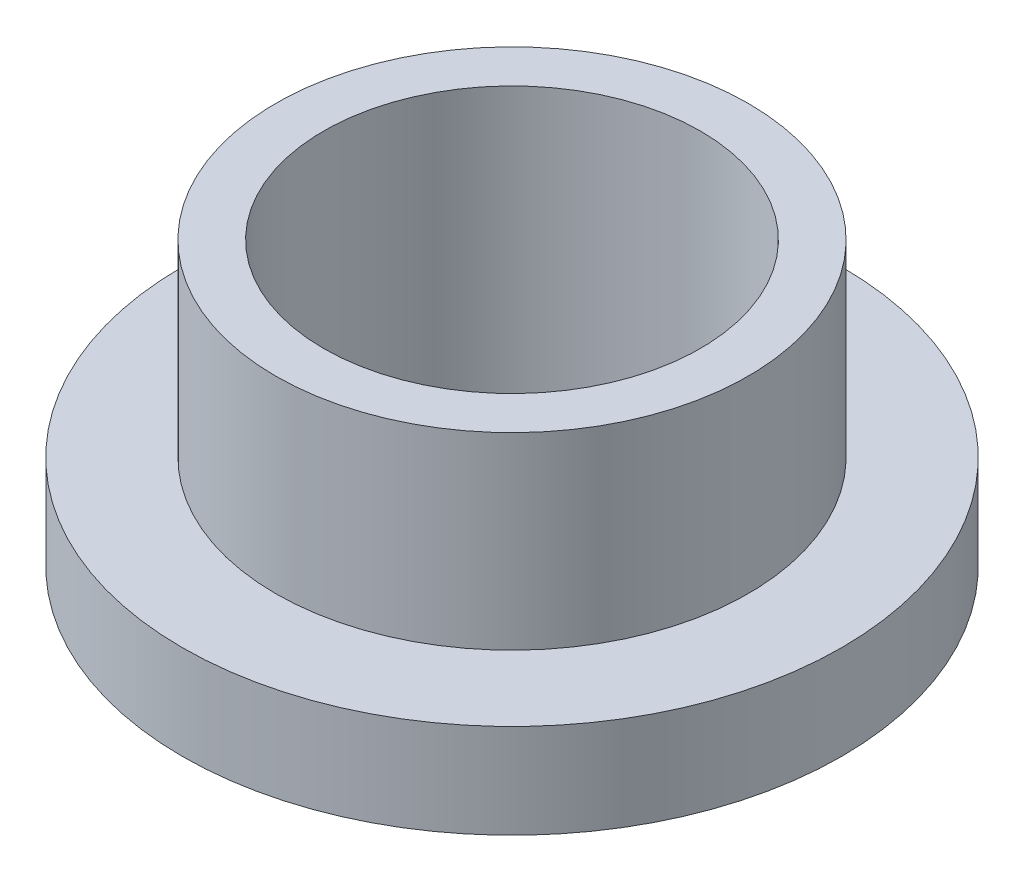
from build123d import *

# Parameters (mm, degrees)
SKETCH2_R           = 7.9629
SKETCH2_R_2         = 6.35
BOSS_EXTRUDE1_DEPTH = 9.525
SKETCH3_R           = 11.1125
SKETCH3_R_2         = 7.9629
BOSS_EXTRUDE2_DEPTH = 3.175


with BuildPart() as part:
    # Sketch2 → Boss-Extrude1 (new body)
    with BuildSketch(Plane(origin=(0, 0, 0), x_dir=(1, 0, 0), z_dir=(0, 1, 0))):
        with Locations(Location((0, 0, 0), (0, 0, 90))):
            Circle(SKETCH2_R)
        with Locations(Location((0, 0, 0), (0, 0, 90))):
            Circle(SKETCH2_R_2, mode=Mode.SUBTRACT)
    extrude(amount=BOSS_EXTRUDE1_DEPTH)

    # Sketch3 → Boss-Extrude2 (add)
    with BuildSketch(Plane(origin=(0, 0, 0), x_dir=(1, 0, 0), z_dir=(0, 1, 0))):
        with Locations(Location((0, 0, 0), (0, 0, 270))):
            Circle(SKETCH3_R)
        with Locations(Location((0, 0, 0), (0, 0, 90))):
            Circle(SKETCH3_R_2, mode=Mode.SUBTRACT)
    extrude(amount=BOSS_EXTRUDE2_DEPTH)


solid = part.part
